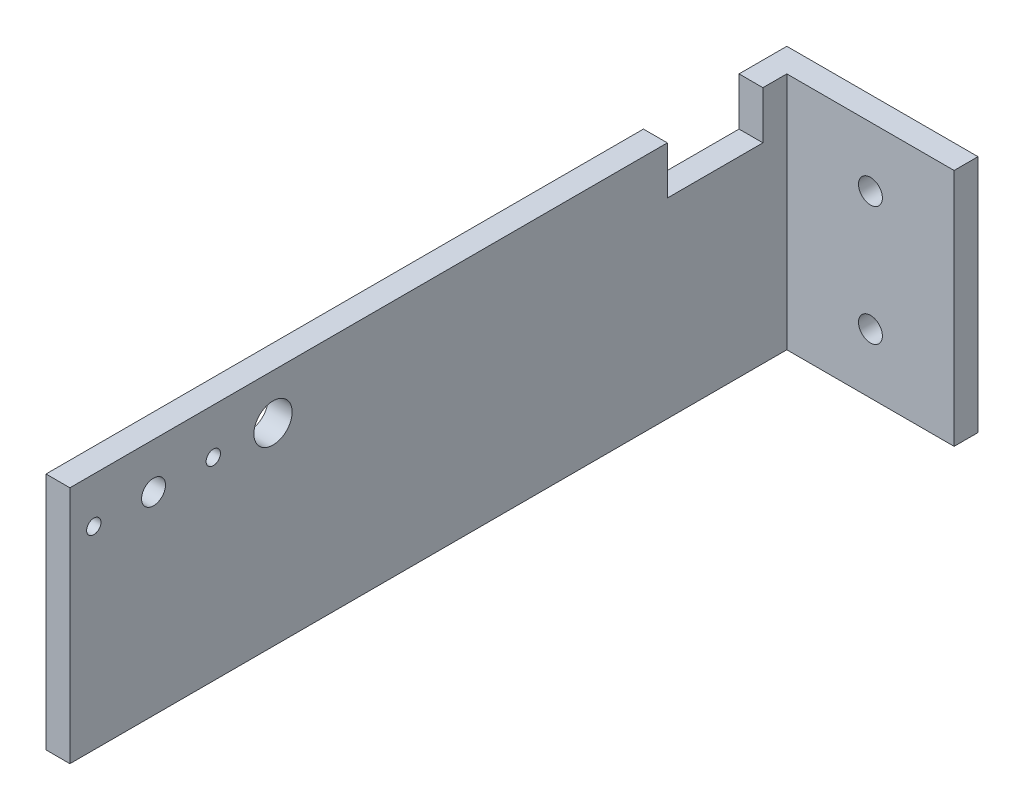
from build123d import *

# Parameters (mm, degrees)
BOSS_EXTRUDE5_DEPTH = 25
CUT_EXTRUDE2_REACH  = 162.857
SKETCH6_R           = 1.5
SKETCH6_R_2         = 2.5
SKETCH6_R_3         = 4
SKETCH6_W           = 20
SKETCH6_H           = 10
CUT_EXTRUDE3_REACH  = 159.242
SKETCH7_R           = 2.5


with BuildPart() as part:
    # Sketch4 → Boss-Extrude5 (new, symmetric)
    with BuildSketch(Plane(origin=(0, 0, 0), x_dir=(1, 0, 0), z_dir=(0, 1, 0))):
        Polygon((0, 0), (5, 0), (5, 150), (40, 150), (40, 155), (0, 155), align=None)
    extrude(amount=BOSS_EXTRUDE5_DEPTH, both=True)

    # Sketch6 → Cut-Extrude2 (cut, up to next)
    with BuildSketch(Plane(origin=(5, 0, 0), x_dir=(0, 0, -1), z_dir=(1, 0, 0)), mode=Mode.PRIVATE) as cut_extrude2_sk1:
        with Locations((5, 15.5)):
            Circle(SKETCH6_R)
    cut_extrude2_tool1 = extrude(cut_extrude2_sk1.sketch, amount=-CUT_EXTRUDE2_REACH, mode=Mode.PRIVATE) & part.part
    # Sketch6 → Cut-Extrude2 (cut, up to next)
    with BuildSketch(Plane(origin=(5, 0, 0), x_dir=(0, 0, -1), z_dir=(1, 0, 0)), mode=Mode.PRIVATE) as cut_extrude2_sk2:
        with Locations((17.5, 15.5)):
            Circle(SKETCH6_R_2)
    cut_extrude2_tool2 = extrude(cut_extrude2_sk2.sketch, amount=-CUT_EXTRUDE2_REACH, mode=Mode.PRIVATE) & part.part
    # Sketch6 → Cut-Extrude2 (cut, up to next)
    with BuildSketch(Plane(origin=(5, 0, 0), x_dir=(0, 0, -1), z_dir=(1, 0, 0)), mode=Mode.PRIVATE) as cut_extrude2_sk3:
        with Locations((30, 15.5)):
            Circle(SKETCH6_R)
    cut_extrude2_tool3 = extrude(cut_extrude2_sk3.sketch, amount=-CUT_EXTRUDE2_REACH, mode=Mode.PRIVATE) & part.part
    # Sketch6 → Cut-Extrude2 (cut, up to next)
    with BuildSketch(Plane(origin=(5, 0, 0), x_dir=(0, 0, -1), z_dir=(1, 0, 0)), mode=Mode.PRIVATE) as cut_extrude2_sk4:
        with Locations((42.5, 15.5)):
            Circle(SKETCH6_R_3)
    cut_extrude2_tool4 = extrude(cut_extrude2_sk4.sketch, amount=-CUT_EXTRUDE2_REACH, mode=Mode.PRIVATE) & part.part
    # Sketch6 → Cut-Extrude2 (cut, up to next)
    with BuildSketch(Plane(origin=(5, 0, 0), x_dir=(0, 0, -1), z_dir=(1, 0, 0)), mode=Mode.PRIVATE) as cut_extrude2_sk5:
        with Locations((135, 20)):
            Rectangle(SKETCH6_W, SKETCH6_H)
    cut_extrude2_tool5 = extrude(cut_extrude2_sk5.sketch, amount=-CUT_EXTRUDE2_REACH, mode=Mode.PRIVATE) & part.part
    add(cut_extrude2_tool1.solids().sort_by_distance((5, 15.5, -5))[0], mode=Mode.SUBTRACT)
    add(cut_extrude2_tool2.solids().sort_by_distance((5, 15.5, -17.5))[0], mode=Mode.SUBTRACT)
    add(cut_extrude2_tool3.solids().sort_by_distance((5, 15.5, -30))[0], mode=Mode.SUBTRACT)
    add(cut_extrude2_tool4.solids().sort_by_distance((5, 15.5, -42.5))[0], mode=Mode.SUBTRACT)
    add(cut_extrude2_tool5.solids().sort_by_distance((5, 20, -135))[0], mode=Mode.SUBTRACT)

    # Sketch7 → Cut-Extrude3 (cut, up to next)
    with BuildSketch(Plane.XY.offset(-150), mode=Mode.PRIVATE) as cut_extrude3_sk1:
        with Locations((22.5, 12.5)):
            Circle(SKETCH7_R)
    cut_extrude3_tool1 = extrude(cut_extrude3_sk1.sketch, amount=-CUT_EXTRUDE3_REACH, mode=Mode.PRIVATE) & part.part
    # Sketch7 → Cut-Extrude3 (cut, up to next)
    with BuildSketch(Plane.XY.offset(-150), mode=Mode.PRIVATE) as cut_extrude3_sk2:
        with Locations((22.5, -12.5)):
            Circle(SKETCH7_R)
    cut_extrude3_tool2 = extrude(cut_extrude3_sk2.sketch, amount=-CUT_EXTRUDE3_REACH, mode=Mode.PRIVATE) & part.part
    add(cut_extrude3_tool1.solids().sort_by_distance((22.5, 12.5, -150))[0], mode=Mode.SUBTRACT)
    add(cut_extrude3_tool2.solids().sort_by_distance((22.5, -12.5, -150))[0], mode=Mode.SUBTRACT)


solid = part.part
